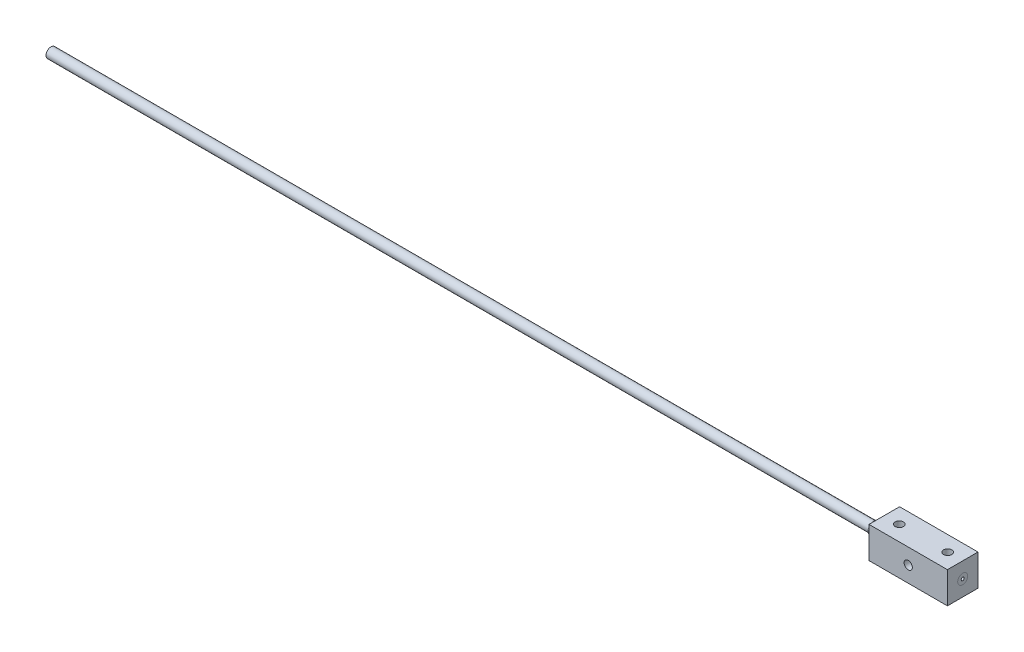
from build123d import *

# Parameters (mm, degrees)
SKETCH_1_W          = 40
SKETCH_1_H          = 15.6
EXTRUDE_1_DEPTH     = 16
SKETCH_2_R          = 2.1
CUT_EXTRUDE_1_DEPTH = 27.773867857
SKETCH_3_R          = 2.55
CUT_EXTRUDE_2_DEPTH = 44.78173135
SKETCH_4_R          = 2.55
SKETCH_4_R_2        = 0.769637984
EXTRUDE_2_DEPTH     = 465
EXTRUDE_START       = 5.3
SKETCH_5_R          = 3
SKETCH_5_R_2        = 2.55
EXTRUDE_3_DEPTH     = 5.3
SKETCH_6_R          = 3.7
SKETCH_6_R_2        = 3
CUT_EXTRUDE_3_DEPTH = 8
SKETCH_8_R          = 2.1
CUT_EXTRUDE_4_DEPTH = 446.560725382


with BuildPart() as part:
    # Эскиз1 → Бобышка-Вытянуть1 (new body)
    with BuildSketch(Plane(origin=(0, 0, 0), x_dir=(1, 0, 0), z_dir=(0, 1, 0))):
        Rectangle(SKETCH_1_W, SKETCH_1_H)
    extrude(amount=EXTRUDE_1_DEPTH)

    # Эскиз2 → Вырез-Вытянуть1 (cut, through all)
    with BuildSketch(Plane(origin=(0, 16, 0), x_dir=(1, 0, 0), z_dir=(0, 1, 0))):
        with Locations(Location((-12.337465342, 0, 0), (0, 0, 270))):
            Circle(SKETCH_2_R)
        with Locations(Location((12.337465342, 0, 0), (0, 0, 90))):
            Circle(SKETCH_2_R)
    extrude(amount=-CUT_EXTRUDE_1_DEPTH, mode=Mode.SUBTRACT)

    # Эскиз3 → Вырез-Вытянуть2 (cut, through all)
    with BuildSketch(Plane.ZY.offset(20)):
        with Locations((0, 8)):
            Circle(SKETCH_3_R)
    extrude(amount=-CUT_EXTRUDE_2_DEPTH, mode=Mode.SUBTRACT)

    # Эскиз5 → Бобышка-Вытянуть3 (add)
    with BuildSketch(Plane.ZY.offset(20).offset(EXTRUDE_START)):
        with Locations(Location((0, 8, 0), (0, 0, 180))):
            Circle(SKETCH_5_R)
        with Locations(Location((0, 8, 0), (0, 0, 180))):
            Circle(SKETCH_5_R_2, mode=Mode.SUBTRACT)
    extrude(amount=-EXTRUDE_3_DEPTH)

    # Эскиз6 → Вырез-Вытянуть3 (cut)
    with BuildSketch(Plane.ZY.offset(25.3)):
        with Locations((0, 8)):
            Circle(SKETCH_6_R)
        with Locations((0, 8)):
            Circle(SKETCH_6_R_2, mode=Mode.SUBTRACT)
    extrude(amount=-CUT_EXTRUDE_3_DEPTH, mode=Mode.SUBTRACT)

    # Эскиз8 → Вырез-Вытянуть4 (cut, through all)
    with BuildSketch(Plane(origin=(0, 0, -7.8), x_dir=(-1, 0, 0), z_dir=(0, 0, -1))):
        with Locations((0, 8)):
            Circle(SKETCH_8_R)
    extrude(amount=-CUT_EXTRUDE_4_DEPTH, mode=Mode.SUBTRACT)


with BuildPart() as body_2:
    # Эскиз4 → Бобышка-Вытянуть2 (new body)
    with BuildSketch(Plane(origin=(20, 0, 0), x_dir=(0, 0, -1), z_dir=(1, 0, 0))):
        with Locations((0, 8)):
            Circle(SKETCH_4_R)
        with Locations((0, 8)):
            Circle(SKETCH_4_R_2, mode=Mode.SUBTRACT)
    extrude(amount=-EXTRUDE_2_DEPTH)


solid = Compound([part.part, body_2.part])
